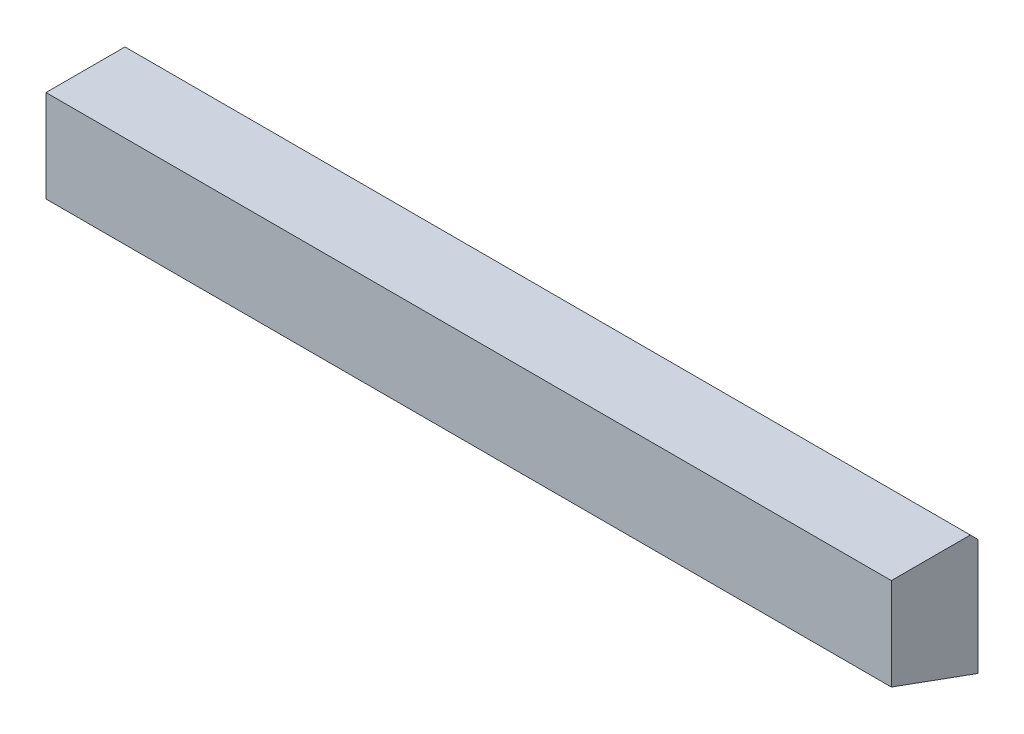
from build123d import *

# Parameters (mm, degrees)
EXTRUDE_1_DEPTH = 55
CHAMFER_1_SIZE  = 0.5


with BuildPart() as part:
    # 草图1 → 凸台-拉伸1 (new body)
    with BuildSketch(Plane(origin=(0, 0, 0), x_dir=(0, 0, -1), z_dir=(1, 0, 0))):
        Polygon((0, 6), (0, 0), (5.638155725, -2.05212086), (5.638155725, 6), align=None)
    extrude(amount=EXTRUDE_1_DEPTH)

    # 倒角1
    chamfer_1_edges = [part.edges().sort_by_distance(p)[0] for p in [
        (27.5, 6, -5.638155725),
    ]]
    chamfer(chamfer_1_edges, length=CHAMFER_1_SIZE)


solid = part.part
